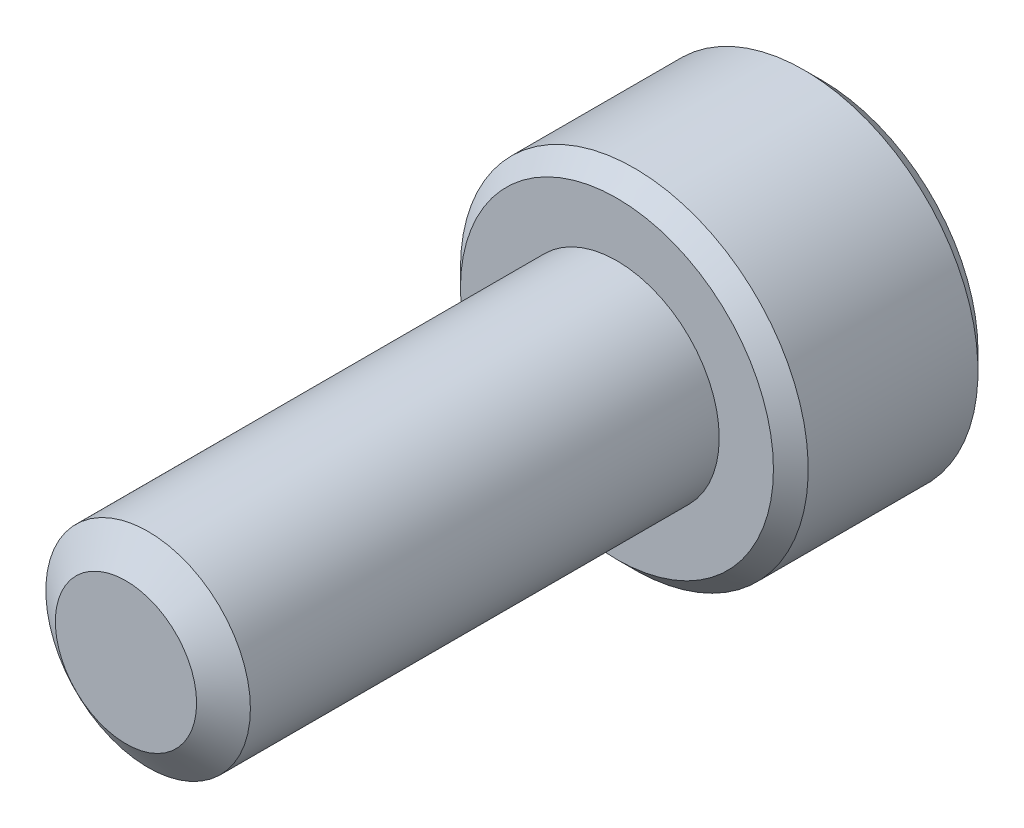
from build123d import *

# Parameters (mm, degrees)
SKETCH1_R          = 2.5
EXTRUDE1_DEPTH     = 12
SKETCH6_R          = 4.25
EXTRUDE2_DEPTH     = 5
CUT_EXTRUDE1_DEPTH = 3
CHAMFER1_SIZE      = 0.425


with BuildPart() as part:
    # Sketch1 → Extrude1 (new body)
    with BuildSketch(Plane.XY):
        Circle(SKETCH1_R)
    extrude(amount=-EXTRUDE1_DEPTH)

    # Sketch4 → Cut-Revolve1 (revolve, cut)
    with BuildSketch(Plane(origin=(0, 0, 0), x_dir=(0, 0, -1), z_dir=(1, 0, 0)), mode=Mode.PRIVATE) as cut_revolve1_sk:
        Polygon((0.541691224, 2.5), (0, 1.726384758), (0, 2.5), align=None)
    revolve(cut_revolve1_sk.sketch.rotate(Axis((0, 0, 0), (0, 0, -1)), 90), axis=Axis((0, 0, 0), (0, 0, -1)), mode=Mode.SUBTRACT)

    # Sketch6 → Extrude2 (add)
    with BuildSketch(Plane(origin=(0, 0, -12), x_dir=(-1, 0, 0), z_dir=(0, 0, -1))):
        Circle(SKETCH6_R)
    extrude(amount=EXTRUDE2_DEPTH)

    # Sketch7 → Cut-Extrude1 (cut)
    with BuildSketch(Plane(origin=(0, 0, -17), x_dir=(-1, 0, 0), z_dir=(0, 0, -1))):
        Polygon((0, 2.309401077), (-2, 1.154700538), (-2, -1.154700538), (0, -2.309401077), (2, -1.154700538), (2, 1.154700538), align=None)
    extrude(amount=-CUT_EXTRUDE1_DEPTH, mode=Mode.SUBTRACT)

    # Cut-Extrude2 cone 1 section (through the dimple's axis) → Cut-Extrude2 (revolve, cut)
    with BuildSketch(Plane(origin=(0, 0, -17), x_dir=(0, 1, 0), z_dir=(1, 0, 0))):
        Polygon((0, 0), (2.309401077, 0), (0, 2.309401077), align=None)
    revolve(axis=Axis((0, 0, -17), (0, 0, 1)), mode=Mode.SUBTRACT)

    # Chamfer1
    chamfer1_edges = [part.edges().sort_by_distance(p)[0] for p in [
        (4.25, 0, -12),
        (4.25, 0, -17),
    ]]
    chamfer(chamfer1_edges, length=CHAMFER1_SIZE)


solid = part.part
